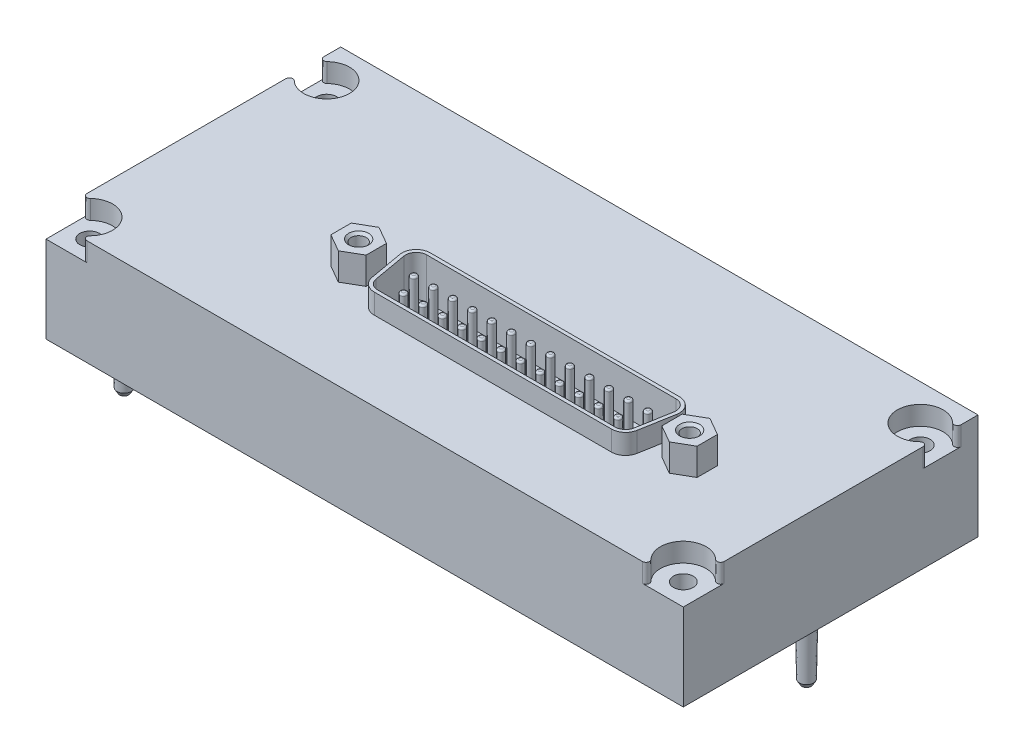
from build123d import *

# Parameters (mm, degrees)
SKIZZE1_W                       = 90.5
SKIZZE1_H                       = 41.85
SKIZZE1_R                       = 1.4
AUFSATZ_LINEAR_AUSTRAGEN1_DEPTH = 15
SKIZZE2_W                       = 110
SKIZZE2_H                       = 70
SCHNITT_LINEAR_AUSTRAGEN1_DEPTH = 2.7
AUFSATZ_LINEAR_AUSTRAGEN2_DEPTH = 3.85
AUFSATZ_LINEAR_AUSTRAGEN3_DEPTH = 3.85
SCHNITT_LINEAR_AUSTRAGEN2_DEPTH = 3
AUFSATZ_LINEAR_START            = 2.84
AUFSATZ_LINEAR_AUSTRAGEN4_DEPTH = 2.84
LINEARES_MUSTER1_COUNT          = 12
LINEARES_MUSTER1_PITCH          = 2.77
LINEARES_MUSTER2_COUNT          = 13
LINEARES_MUSTER2_PITCH          = 2.77


with BuildPart() as part:
    # Skizze1 → Aufsatz-Linear austragen1 (new body)
    with BuildSketch(Plane(origin=(0, 0, 0), x_dir=(1, 0, 0), z_dir=(0, 1, 0))):
        with Locations((11, -5.675)):
            Rectangle(SKIZZE1_W, SKIZZE1_H)
        with Locations((53.15, -23.5)):
            Circle(SKIZZE1_R, mode=Mode.SUBTRACT)
        with Locations((53.15, 10.15)):
            Circle(SKIZZE1_R, mode=Mode.SUBTRACT)
        with Locations((-31.15, -23.5)):
            Circle(SKIZZE1_R, mode=Mode.SUBTRACT)
        with Locations((-31.15, 10.15)):
            Circle(SKIZZE1_R, mode=Mode.SUBTRACT)
    extrude(amount=AUFSATZ_LINEAR_AUSTRAGEN1_DEPTH)

    # Skizze2 → Schnitt-Linear austragen1 (cut)
    with BuildSketch(Plane(origin=(0, 15, 0), x_dir=(1, 0, 0), z_dir=(0, 1, 0))):
        with Locations((10, -5)):
            Rectangle(SKIZZE2_W, SKIZZE2_H)
        with BuildLine():
            Line((-34.25, 7.447686177), (-34.25, -20.797686177))
            ThreePointArc((-34.25, -20.797686177), (-33.945789002, -21.257758635), (-33.403333333, -21.157994686))
            ThreePointArc((-33.403333333, -21.157994686), (-28.851902961, -21.201902961), (-28.807994686, -25.753333333))
            ThreePointArc((-28.807994686, -25.753333333), (-28.907758635, -26.295789002), (-28.447686177, -26.6))
            Line((-28.447686177, -26.6), (50.447686177, -26.6))
            ThreePointArc((50.447686177, -26.6), (50.907758646, -26.295788975), (50.807994645, -25.753333291))
            ThreePointArc((50.807994645, -25.753333291), (50.851902982, -21.20190294), (55.403333333, -21.157994686))
            ThreePointArc((55.403333333, -21.157994686), (55.945789002, -21.257758635), (56.25, -20.797686177))
            Line((56.25, -20.797686177), (56.25, 7.447686177))
            ThreePointArc((56.25, 7.447686177), (55.945788972, 7.907758648), (55.403333286, 7.807994641))
            ThreePointArc((55.403333286, 7.807994641), (49.9, 10.150000033), (55.403333333, 12.492005314))
            ThreePointArc((55.403333333, 12.492005314), (55.945789002, 12.392241365), (56.25, 12.852313823))
            Line((56.25, 12.852313823), (56.25, 15.25))
            Line((56.25, 15.25), (-34.25, 15.25))
            Line((-34.25, 15.25), (-34.25, 12.852313823))
            ThreePointArc((-34.25, 12.852313823), (-33.945789002, 12.392241365), (-33.403333333, 12.492005314))
            ThreePointArc((-33.403333333, 12.492005314), (-27.9, 10.15000003), (-33.40333329, 7.807994645))
            ThreePointArc((-33.40333329, 7.807994645), (-33.945788975, 7.907758646), (-34.25, 7.447686177))
        make_face(mode=Mode.SUBTRACT)
    extrude(amount=-SCHNITT_LINEAR_AUSTRAGEN1_DEPTH, mode=Mode.SUBTRACT)

    # Skizze3 → Rotation1 (revolve)
    with BuildSketch(Plane.XY.offset(6)):
        Polygon((53.15, 0), (54.3, 0), (54.15, -8.4), (53.8, -9), (53.15, -9), align=None)
    revolve(axis=Axis((53.15, -9, 6), (0, 1, 0)))

    # Skizze4 → Rotation2 (revolve)
    with BuildSketch(Plane.XY.offset(-5.25)):
        Polygon((-31.15, 0), (-30, 0), (-30.15, -8.4), (-30.5, -9), (-31.15, -9), align=None)
    revolve(axis=Axis((-31.15, -9, -5.25), (0, 1, 0)))

    # Skizze5 → Rotation3 (revolve)
    with BuildSketch(Plane.XY.offset(18.6)):
        Polygon((-31.15, 0), (-30, 0), (-30.15, -8.4), (-30.5, -9), (-31.15, -9), align=None)
    revolve(axis=Axis((-31.15, -9, 18.6), (0, 1, 0)))

    # Skizze6 → Aufsatz-Linear austragen2 (add)
    with BuildSketch(Plane(origin=(0, 15, 0), x_dir=(1, 0, 0), z_dir=(0, 1, 0))):
        Polygon((39, -12.393375673), (41.5, -13.836751346), (44, -12.393375673), (44, -9.506624327), (41.5, -8.063248654), (39, -9.506624327), align=None)
    extrude(amount=AUFSATZ_LINEAR_AUSTRAGEN2_DEPTH)

    # Skizze7 → Aufsatz-Linear austragen3 (add)
    with BuildSketch(Plane(origin=(0, 15, 0), x_dir=(1, 0, 0), z_dir=(0, 1, 0))):
        Polygon((-8, -12.393375673), (-5.5, -13.836751346), (-3, -12.393375673), (-3, -9.506624327), (-5.5, -8.063248654), (-8, -9.506624327), align=None)
    extrude(amount=AUFSATZ_LINEAR_AUSTRAGEN3_DEPTH)

    # Skizze8 → Schnitt-Linear austragen2 (cut)
    with BuildSketch(Plane(origin=(0, 15, 0), x_dir=(1, 0, 0), z_dir=(0, 1, 0))):
        with BuildLine():
            Line((-1.209581241, -8.810472267), (-0.363211733, -13.610472267))
            ThreePointArc((-0.363211733, -13.610472267), (0.149818482, -14.499066665), (1.113999896, -14.85))
            Line((1.113999896, -14.85), (34.806000104, -14.85))
            ThreePointArc((34.806000104, -14.85), (35.770181518, -14.499066665), (36.283211733, -13.610472267))
            Line((36.283211733, -13.610472267), (37.129581241, -8.810472267))
            ThreePointArc((37.129581241, -8.810472267), (36.801436276, -7.585818585), (35.652369611, -7.05))
            Line((35.652369611, -7.05), (0.267630389, -7.05))
            ThreePointArc((0.267630389, -7.05), (-0.881436276, -7.585818585), (-1.209581241, -8.810472267))
        make_face()
    extrude(amount=-SCHNITT_LINEAR_AUSTRAGEN2_DEPTH, mode=Mode.SUBTRACT)

    # Skizze9 → Aufsatz-Linear austragen4 (add)
    with BuildSketch(Plane(origin=(0, 15, 0), x_dir=(1, 0, 0), z_dir=(0, 1, 0)).offset(AUFSATZ_LINEAR_START)):
        with BuildLine():
            Line((-1.701985117, -8.897296355), (-0.85561561, -13.697296355))
            ThreePointArc((-0.85561561, -13.697296355), (-0.171575323, -14.882088886), (1.113999896, -15.35))
            Line((1.113999896, -15.35), (34.806000104, -15.35))
            ThreePointArc((34.806000104, -15.35), (36.091575323, -14.882088886), (36.77561561, -13.697296355))
            Line((36.77561561, -13.697296355), (37.621985117, -8.897296355))
            ThreePointArc((37.621985117, -8.897296355), (37.184458497, -7.264424781), (35.652369611, -6.55))
            Line((35.652369611, -6.55), (0.267630389, -6.55))
            ThreePointArc((0.267630389, -6.55), (-1.264458497, -7.264424781), (-1.701985117, -8.897296355))
        make_face()
        with BuildLine():
            Line((-1.209581241, -8.810472267), (-0.363211733, -13.610472267))
            ThreePointArc((-0.363211733, -13.610472267), (0.149818482, -14.499066665), (1.113999896, -14.85))
            Line((1.113999896, -14.85), (34.806000104, -14.85))
            ThreePointArc((34.806000104, -14.85), (35.770181518, -14.499066665), (36.283211733, -13.610472267))
            Line((36.283211733, -13.610472267), (37.129581241, -8.810472267))
            ThreePointArc((37.129581241, -8.810472267), (36.801436276, -7.585818585), (35.652369611, -7.05))
            Line((35.652369611, -7.05), (0.267630389, -7.05))
            ThreePointArc((0.267630389, -7.05), (-0.881436276, -7.585818585), (-1.209581241, -8.810472267))
        make_face(mode=Mode.SUBTRACT)
    extrude(amount=-AUFSATZ_LINEAR_AUSTRAGEN4_DEPTH)

    # Skizze10 → Schnitt-Rotation1 (revolve, cut)
    with BuildSketch(Plane.XY.offset(10.95)):
        Polygon((41.5, 18.85), (42.9224, 18.85), (42.57823, 18.50583), (42.57823, 14.472516381), (41.5, 13.85), align=None)
    revolve(axis=Axis((41.5, 13.85, 10.95), (0, 1, 0)), mode=Mode.SUBTRACT)

    # Skizze11 → Schnitt-Rotation2 (revolve, cut)
    with BuildSketch(Plane.XY.offset(10.95)):
        Polygon((-5.5, 18.85), (-4.0776, 18.85), (-4.42177, 18.50583), (-4.42177, 14.472516381), (-5.5, 13.85), align=None)
    revolve(axis=Axis((-5.5, 13.85, 10.95), (0, 1, 0)), mode=Mode.SUBTRACT)

    # Skizze12 → Rotation4 (revolve)
    with BuildSketch(Plane.XY.offset(12.37)):
        with BuildLine():
            Line((2.305, 17), (2.53, 17))
            ThreePointArc((2.53, 17), (2.706776695, 16.926776695), (2.78, 16.75))
            Line((2.78, 16.75), (2.78, 12))
            Line((2.78, 12), (2.305, 12))
            Line((2.305, 12), (2.305, 17))
        make_face()
    rotation4 = revolve(axis=Axis((2.305, 12, 12.37), (0, 1, 0)))

    # Lineares Muster1: Rotation4 ×12
    with Locations(*[(i * LINEARES_MUSTER1_PITCH, 0, 0) for i in range(1, LINEARES_MUSTER1_COUNT)]):
        add(rotation4)

    # Skizze14 → Rotation5 (revolve)
    with BuildSketch(Plane.XY.offset(9.53)):
        with BuildLine():
            Line((0.92, 17), (1.145, 17))
            ThreePointArc((1.145, 17), (1.321776695, 16.926776695), (1.395, 16.75))
            Line((1.395, 16.75), (1.395, 12))
            Line((1.395, 12), (0.92, 12))
            Line((0.92, 12), (0.92, 17))
        make_face()
    rotation5 = revolve(axis=Axis((0.92, 12, 9.53), (0, 1, 0)))

    # Lineares Muster2: Rotation5 ×13
    with Locations(*[(i * LINEARES_MUSTER2_PITCH, 0, 0) for i in range(1, LINEARES_MUSTER2_COUNT)]):
        add(rotation5)


solid = part.part
